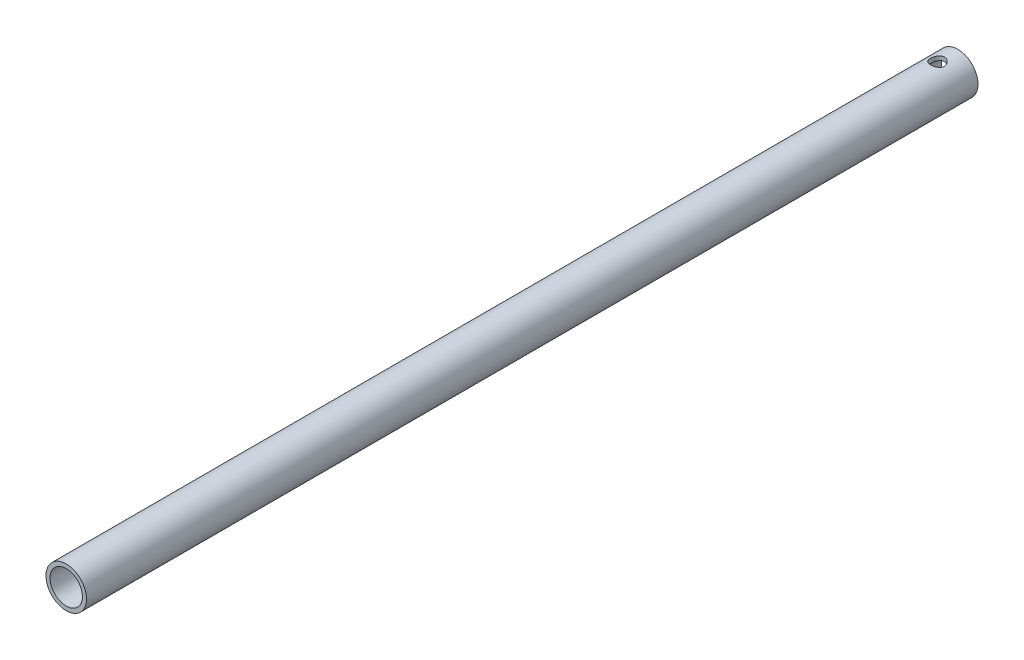
from build123d import *

# Parameters (mm, degrees)
SKETCH_1_R          = 5
SKETCH_1_R_2        = 4
EXTRUDE_1_DEPTH     = 220
SKETCH_2_R          = 1.7
CUT_EXTRUDE_1_DEPTH = 10
CUT_EXTRUDE_START   = 16
SKETCH_3_R          = 1.7
CUT_EXTRUDE_3_DEPTH = 16


with BuildPart() as part:
    # 草图1 → 拉伸1 (new body)
    with BuildSketch(Plane.XY):
        Circle(SKETCH_1_R)
        Circle(SKETCH_1_R_2, mode=Mode.SUBTRACT)
    extrude(amount=EXTRUDE_1_DEPTH)

    # 草图2 → 切除-拉伸1 (cut)
    with BuildSketch(Plane(origin=(0, 0, 0), x_dir=(1, 0, 0), z_dir=(0, 1, 0))):
        with Locations(Location((0, -5, 0), (0, 0, 270))):
            Circle(SKETCH_2_R)
        with BuildLine():
            Line((-2, -210), (-2, -20))
            ThreePointArc((-2, -20), (0, -18), (2, -20))
            Line((2, -20), (2, -210))
            ThreePointArc((2, -210), (0, -212), (-2, -210))
        make_face()
    extrude(amount=-CUT_EXTRUDE_1_DEPTH, mode=Mode.SUBTRACT)

    # 草图3 → 切除-拉伸3 (cut)
    with BuildSketch(Plane(origin=(0, 0, 0), x_dir=(1, 0, 0), z_dir=(0, 1, 0)).offset(CUT_EXTRUDE_START)):
        with Locations(Location((0, -5, 0), (0, 0, 270))):
            Circle(SKETCH_3_R)
    extrude(amount=-CUT_EXTRUDE_3_DEPTH, mode=Mode.SUBTRACT)


solid = part.part
